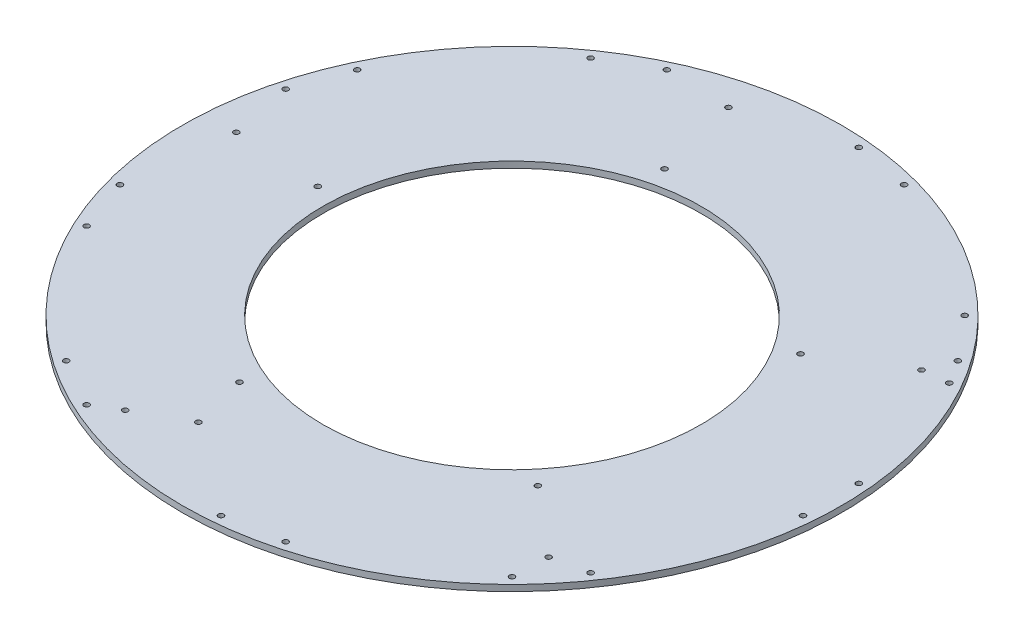
from build123d import *

# Parameters (mm, degrees)
SKETCH1_R                     = 309.88
SKETCH1_R_2                   = 177.8
BOSS_EXTRUDE1_DEPTH           = 5.842
SKETCH2_R                     = 2.5527
CUT_EXTRUDE1_DEPTH            = 439.275435958
CIRPATTERN1_COUNT             = 9
SKETCH3_R                     = 2.5527
HOLES_MOUNTINGFEET_DEPTH      = 439.275435958
CIRPATTERN_MOUNTINGFEET_COUNT = 5
SKETCH4_R                     = 2.5527
HOLE_WIRES_DEPTH              = 439.275435958
SKETCH5_R                     = 2.5527
CUT_EXTRUDE2_DEPTH            = 439.275435958


with BuildPart() as part:
    # Sketch1 → Boss-Extrude1 (new body)
    with BuildSketch(Plane(origin=(0, 0, 0), x_dir=(1, 0, 0), z_dir=(0, 1, 0))):
        Circle(SKETCH1_R)
        Circle(SKETCH1_R_2, mode=Mode.SUBTRACT)
    extrude(amount=BOSS_EXTRUDE1_DEPTH)

    # Sketch2 → Cut-Extrude1 (cut, through all)
    with BuildSketch(Plane(origin=(0, 5.842, 0), x_dir=(1, 0, 0), z_dir=(0, 1, 0))):
        with Locations((-290.734014455, -77.901944385)):
            Circle(SKETCH2_R)
        with Locations((-290.734014455, 77.901944385)):
            Circle(SKETCH2_R)
    cut_extrude1 = extrude(amount=-CUT_EXTRUDE1_DEPTH, mode=Mode.SUBTRACT)

    # CirPattern1: Cut-Extrude1 ×9 about axis
    cirpattern1_axis = Axis((0, 6.6675, 0), (0, -1, 0))
    for i in range(1, CIRPATTERN1_COUNT):
        add(cut_extrude1.rotate(cirpattern1_axis, i * 360 / CIRPATTERN1_COUNT), mode=Mode.SUBTRACT)

    # Sketch3 → Holes_MountingFeet (cut, through all)
    with BuildSketch(Plane(origin=(0, 5.842, 0), x_dir=(1, 0, 0), z_dir=(0, 1, 0))):
        with Locations((-196.370483294, 13.731561857)):
            Circle(SKETCH3_R)
        with Locations((-278.719395643, 19.489958764)):
            Circle(SKETCH3_R)
    holes_mountingfeet = extrude(amount=-HOLES_MOUNTINGFEET_DEPTH, mode=Mode.SUBTRACT)

    # CirPattern_MountingFeet: Holes_MountingFeet ×5 about axis
    cirpattern_mountingfeet_axis = Axis((0, 6.6675, 0), (0, -1, 0))
    for i in range(1, CIRPATTERN_MOUNTINGFEET_COUNT):
        add(holes_mountingfeet.rotate(cirpattern_mountingfeet_axis, i * 360 / CIRPATTERN_MOUNTINGFEET_COUNT), mode=Mode.SUBTRACT)

    # Sketch4 → Hole_Wires (cut, through all)
    with BuildSketch(Plane(origin=(0, 5.842, 0), x_dir=(1, 0, 0), z_dir=(0, 1, 0))):
        with Locations((260.664986285, 150.495)):
            Circle(SKETCH4_R)
    extrude(amount=-HOLE_WIRES_DEPTH, mode=Mode.SUBTRACT)

    # Sketch5 → Cut-Extrude2 (cut, through all)
    with BuildSketch(Plane(origin=(0, 5.842, 0), x_dir=(1, 0, 0), z_dir=(0, 1, 0))):
        with Locations((-60.478733235, -234.445699953)):
            Circle(SKETCH5_R)
    extrude(amount=-CUT_EXTRUDE2_DEPTH, mode=Mode.SUBTRACT)


solid = part.part
